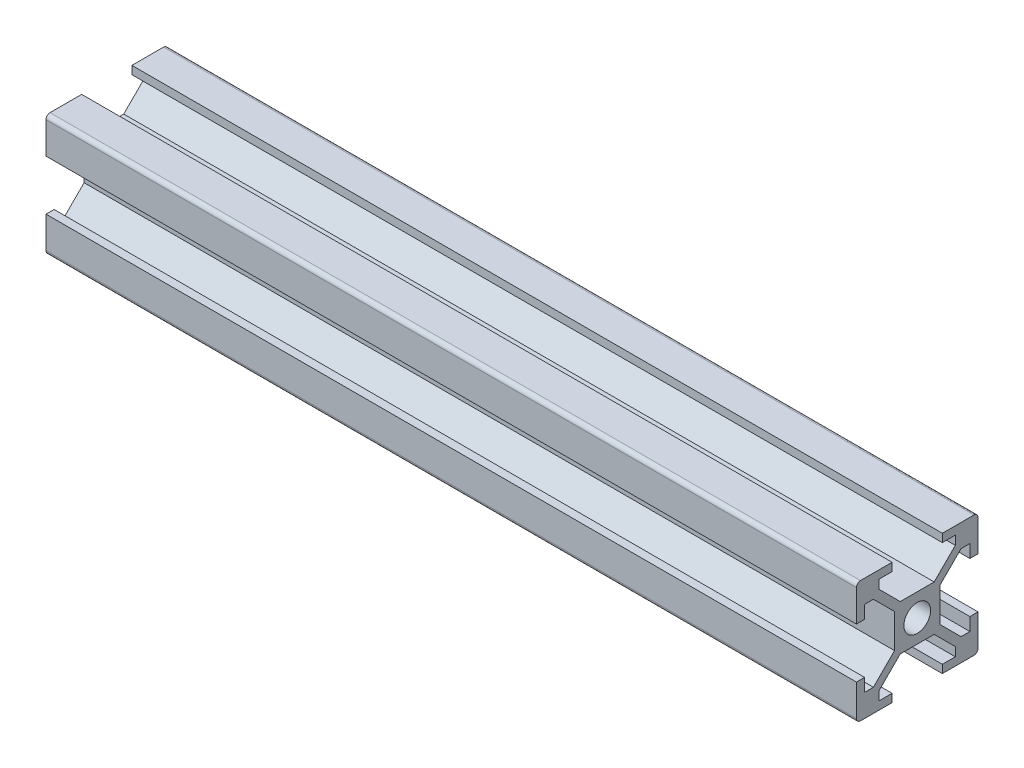
from build123d import *

# Parameters (mm, degrees)
EXTRUDE_1_DEPTH          = 100
CUT_EXTRUDE_2_DEPTH      = 101.560926806
CUT_EXTRUDE_2_DEPTH_BACK = 101.560926806
SKETCH_2_4_R             = 1.65


with BuildPart() as part:
    # 草图2 → 凸台-拉伸1 (new body)
    with BuildSketch(Plane(origin=(0, 0, 0), x_dir=(0, 0, -1), z_dir=(1, 0, 0))):
        with BuildLine():
            Line((-7, 7.5), (7, 7.5))
            ThreePointArc((7, 7.5), (7.353553391, 7.353553391), (7.5, 7))
            Line((7.5, 7), (7.5, -7))
            ThreePointArc((7.5, -7), (7.353553391, -7.353553391), (7, -7.5))
            Line((7, -7.5), (-7, -7.5))
            ThreePointArc((-7, -7.5), (-7.353553391, -7.353553391), (-7.5, -7))
            Line((-7.5, -7), (-7.5, 7))
            ThreePointArc((-7.5, 7), (-7.353553391, 7.353553391), (-7, 7.5))
        make_face()
    extrude(amount=EXTRUDE_1_DEPTH)

    # 草图2<4> → 切除-拉伸2 (cut, two sides: drawn at the far end of the back side and taken through both)
    with BuildSketch(Plane(origin=(0, 0, 0), x_dir=(0, 0, -1), z_dir=(1, 0, 0)).offset(-CUT_EXTRUDE_2_DEPTH_BACK)):
        Polygon((3.1, 7.5), (-3.1, 7.5), (-3.1, 6.5), (-4.7, 6.5), (-4.7, 5.407106781), (-2.092893219, 2.8), (2.092893219, 2.8), (4.7, 5.407106781), (4.7, 6.5), (3.1, 6.5), align=None)
        Polygon((-6.5, 3.1), (-7.5, 3.1), (-7.5, -3.1), (-6.5, -3.1), (-6.5, -4.7), (-5.407106781, -4.7), (-2.8, -2.092893219), (-2.8, 2.092893219), (-5.407106781, 4.7), (-6.5, 4.7), align=None)
        Polygon((7.5, -3.1), (7.5, 3.1), (6.5, 3.1), (6.5, 4.7), (5.407106781, 4.7), (2.8, 2.092893219), (2.8, -2.092893219), (5.407106781, -4.7), (6.5, -4.7), (6.5, -3.1), align=None)
        Polygon((-3.1, -6.5), (-3.1, -7.5), (3.1, -7.5), (3.1, -6.5), (4.7, -6.5), (4.7, -5.407106781), (2.092893219, -2.8), (-2.092893219, -2.8), (-4.7, -5.407106781), (-4.7, -6.5), align=None)
        Circle(SKETCH_2_4_R)
    extrude(amount=CUT_EXTRUDE_2_DEPTH + CUT_EXTRUDE_2_DEPTH_BACK, mode=Mode.SUBTRACT)


solid = part.part
